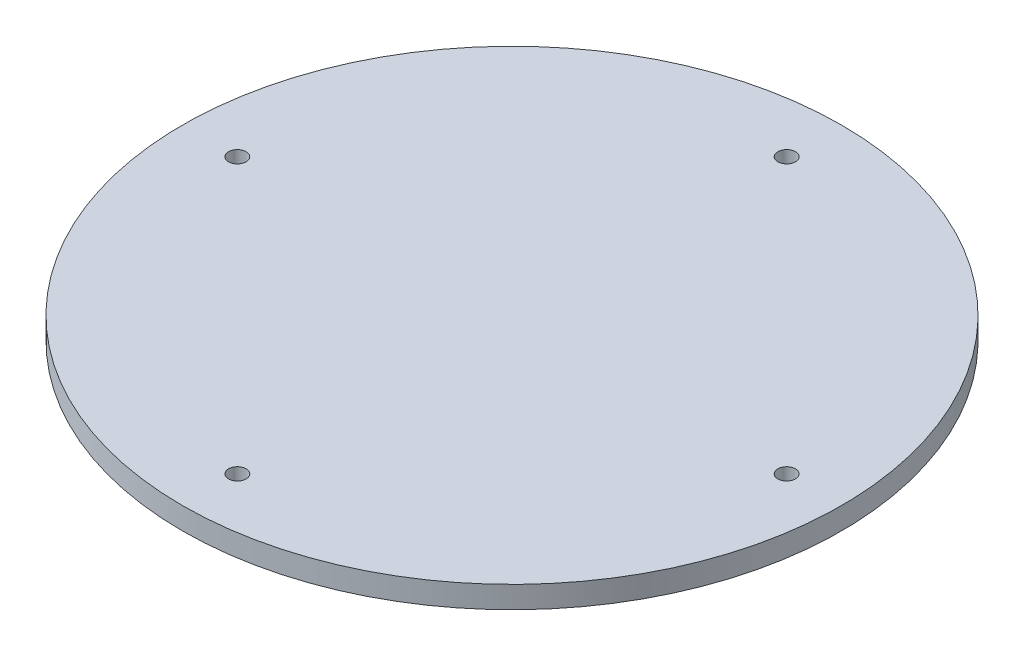
from build123d import *

# Parameters (mm, degrees)
SKETCH1_R           = 75
SKETCH1_R_2         = 2
BOSS_EXTRUDE1_DEPTH = 5


with BuildPart() as part:
    # Sketch1 → Boss-Extrude1 (new body)
    with BuildSketch(Plane(origin=(0, 0, 0), x_dir=(1, 0, 0), z_dir=(0, 1, 0))):
        with Locations(Location((0, 0, 0), (0, 0, 270))):
            Circle(SKETCH1_R)
        with Locations(Location((0, 62.5, 0), (0, 0, 270))):
            Circle(SKETCH1_R_2, mode=Mode.SUBTRACT)
        with Locations(Location((62.5, 0, 0), (0, 0, 270))):
            Circle(SKETCH1_R_2, mode=Mode.SUBTRACT)
        with Locations(Location((0, -62.5, 0), (0, 0, 270))):
            Circle(SKETCH1_R_2, mode=Mode.SUBTRACT)
        with Locations(Location((-62.5, 0, 0), (0, 0, 270))):
            Circle(SKETCH1_R_2, mode=Mode.SUBTRACT)
    extrude(amount=BOSS_EXTRUDE1_DEPTH)


solid = part.part
